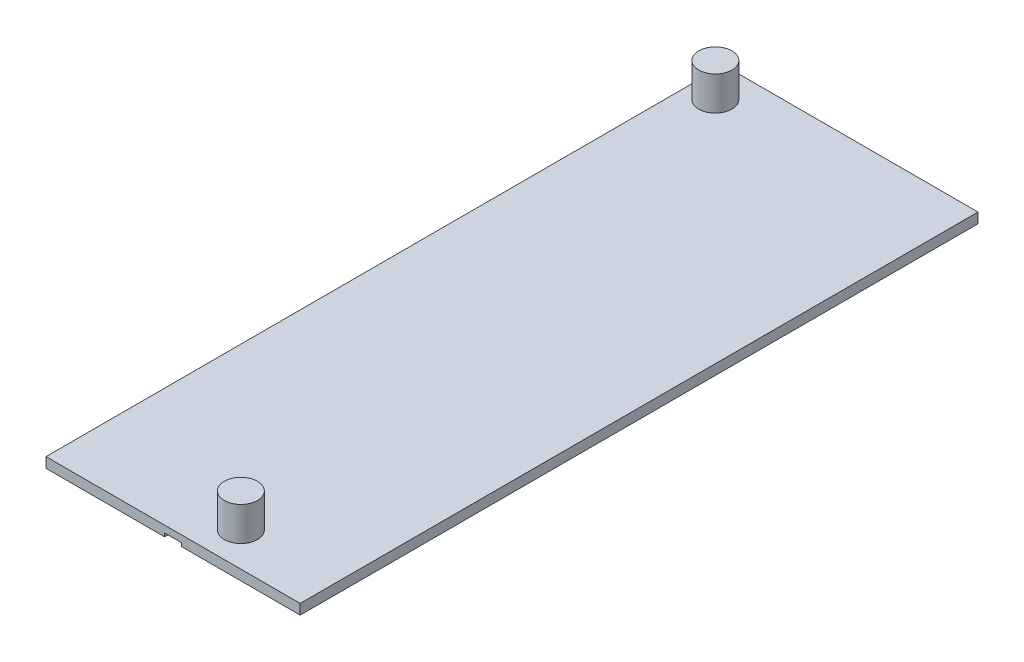
from build123d import *

# Parameters (mm, degrees)
SKETCH1_W           = 75
SKETCH1_H           = 3
BOSS_EXTRUDE1_DEPTH = 200
SKETCH2_R           = 4.9
BOSS_EXTRUDE2_DEPTH = 10
SKETCH3_W           = 5
SKETCH3_H           = 200
CUT_EXTRUDE1_DEPTH  = 1


with BuildPart() as part:
    # Sketch1 → Boss-Extrude1 (new body)
    with BuildSketch(Plane.XY):
        with Locations((37.5, 1.5)):
            Rectangle(SKETCH1_W, SKETCH1_H)
    extrude(amount=BOSS_EXTRUDE1_DEPTH)

    # Sketch2 → Boss-Extrude2 (add)
    with BuildSketch(Plane(origin=(0, 3, 0), x_dir=(1, 0, 0), z_dir=(0, 1, 0))):
        with Locations(Location((7.5, -10, 0), (0, 0, 90))):
            Circle(SKETCH2_R)
        with Locations(Location((47.5, -190, 0), (0, 0, 90))):
            Circle(SKETCH2_R)
    extrude(amount=BOSS_EXTRUDE2_DEPTH)

    # Sketch3 → Cut-Extrude1 (cut)
    with BuildSketch(Plane.XZ):
        with Locations((37.5, 100)):
            Rectangle(SKETCH3_W, SKETCH3_H)
    extrude(amount=-CUT_EXTRUDE1_DEPTH, mode=Mode.SUBTRACT)


solid = part.part
